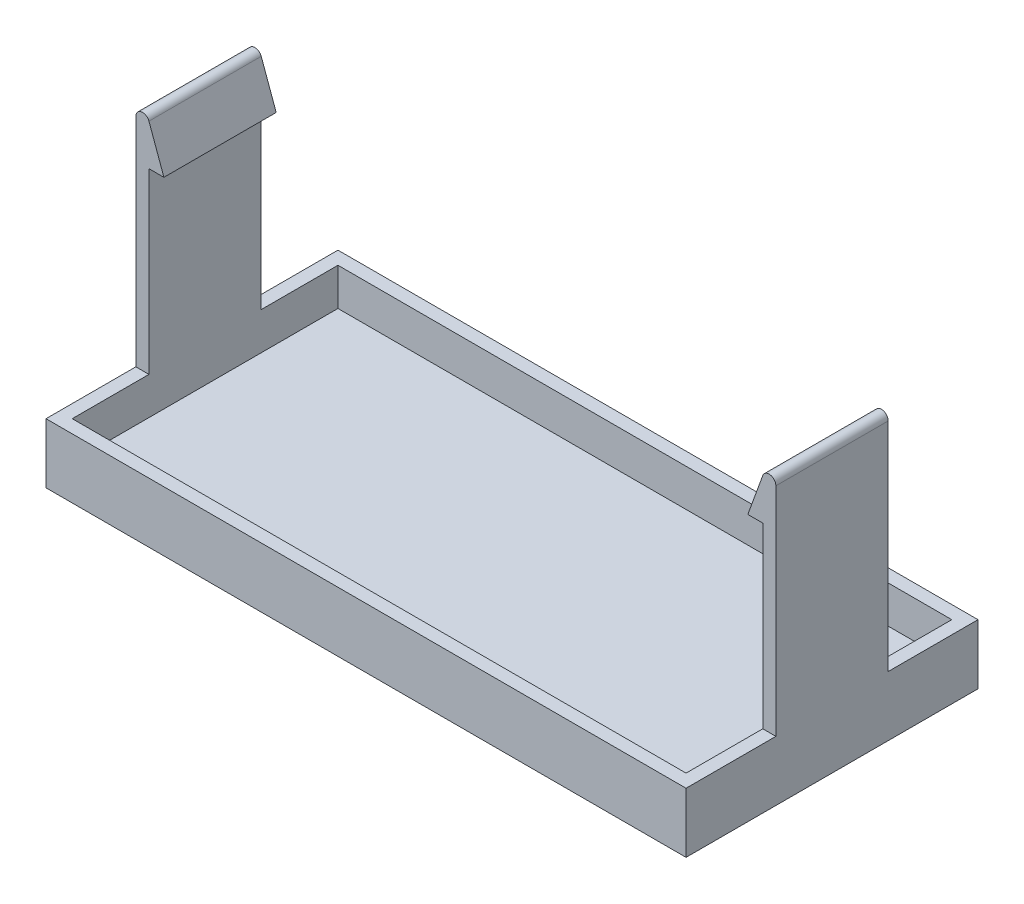
from build123d import *

# Parameters (mm, degrees)
SKETCH1_W           = 85.5
SKETCH1_H           = 39
BOSS_EXTRUDE1_DEPTH = 3
SKETCH2_W           = 85.5
SKETCH2_H           = 39
SKETCH2_W_2         = 82
SKETCH2_H_2         = 35.5
BOSS_EXTRUDE2_DEPTH = 5
SKETCH3_W           = 1.75
SKETCH3_H           = 15
BOSS_EXTRUDE3_DEPTH = 23.8
BOSS_EXTRUDE4_DEPTH = 15


with BuildPart() as part:
    # Sketch1 → Boss-Extrude1 (new body)
    with BuildSketch(Plane(origin=(0, 0, 0), x_dir=(1, 0, 0), z_dir=(0, 1, 0))):
        with Locations((42.75, 19.5)):
            Rectangle(SKETCH1_W, SKETCH1_H)
    extrude(amount=BOSS_EXTRUDE1_DEPTH)

    # Sketch2 → Boss-Extrude2 (add)
    with BuildSketch(Plane(origin=(0, 3, 0), x_dir=(1, 0, 0), z_dir=(0, 1, 0))):
        with Locations((42.75, 19.5)):
            Rectangle(SKETCH2_W, SKETCH2_H)
        with Locations((42.75, 19.5)):
            Rectangle(SKETCH2_W_2, SKETCH2_H_2, mode=Mode.SUBTRACT)
    extrude(amount=BOSS_EXTRUDE2_DEPTH)

    # Sketch3 → Boss-Extrude3 (add)
    with BuildSketch(Plane(origin=(0, 8, 0), x_dir=(1, 0, 0), z_dir=(0, 1, 0))):
        with Locations((0.875, 19.5)):
            Rectangle(SKETCH3_W, SKETCH3_H)
        with Locations((84.625, 19.5)):
            Rectangle(SKETCH3_W, SKETCH3_H)
    extrude(amount=BOSS_EXTRUDE3_DEPTH)

    # Sketch4 → Boss-Extrude4 (add)
    with BuildSketch(Plane.XY.offset(-12)):
        with BuildLine():
            Line((1.75, 31.8), (3.75, 31.8))
            Line((3.75, 31.8), (1.75, 37.294954839))
            ThreePointArc((1.75, 37.294954839), (0.745538584, 37.874880908), (0, 36.986382623))
            Line((0, 36.986382623), (0, 31.8))
            Line((0, 31.8), (1.75, 31.8))
        make_face()
        with BuildLine():
            Line((83.75, 31.8), (85.5, 31.8))
            Line((85.5, 31.8), (85.5, 36.986382623))
            ThreePointArc((85.5, 36.986382623), (84.754461416, 37.874880908), (83.75, 37.294954839))
            Line((83.75, 37.294954839), (81.75, 31.8))
            Line((81.75, 31.8), (83.75, 31.8))
        make_face()
    extrude(amount=-BOSS_EXTRUDE4_DEPTH)


solid = part.part
